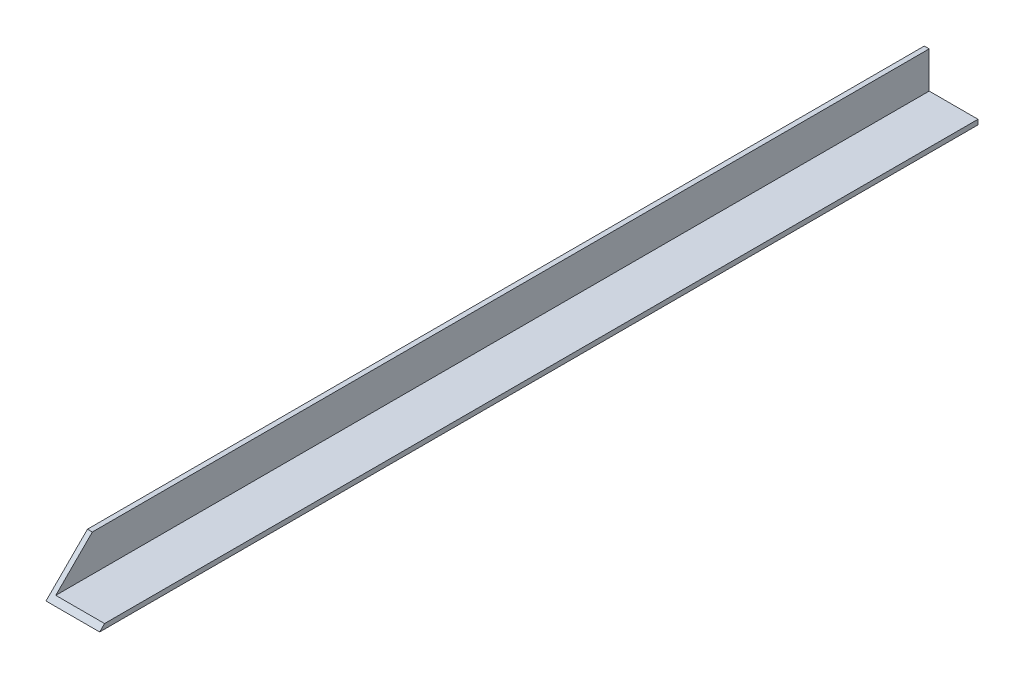
from build123d import *

# Parameters (mm, degrees)
BOSS_EXTRUDE1_DEPTH     = 360
CUT_EXTRUDE1_DEPTH      = 361.955675949
CUT_EXTRUDE1_DEPTH_BACK = 361.955675949


with BuildPart() as part:
    # Sketch1 → Boss-Extrude1 (new body)
    with BuildSketch(Plane.XY):
        Polygon((0, 0), (0, 17), (2, 17), (2, 2), (22, 2), (22, 0), align=None)
    extrude(amount=-BOSS_EXTRUDE1_DEPTH)

    # Sketch2 → Cut-Extrude1 (cut, two sides: drawn at the far end of the back side and taken through both)
    with BuildSketch(Plane(origin=(2, 0, 0), x_dir=(0, 0, -1), z_dir=(1, 0, 0)).offset(-CUT_EXTRUDE1_DEPTH_BACK)):
        Polygon((0, 0), (0, 17), (17, 17), align=None)
    extrude(amount=CUT_EXTRUDE1_DEPTH + CUT_EXTRUDE1_DEPTH_BACK, mode=Mode.SUBTRACT)


solid = part.part
